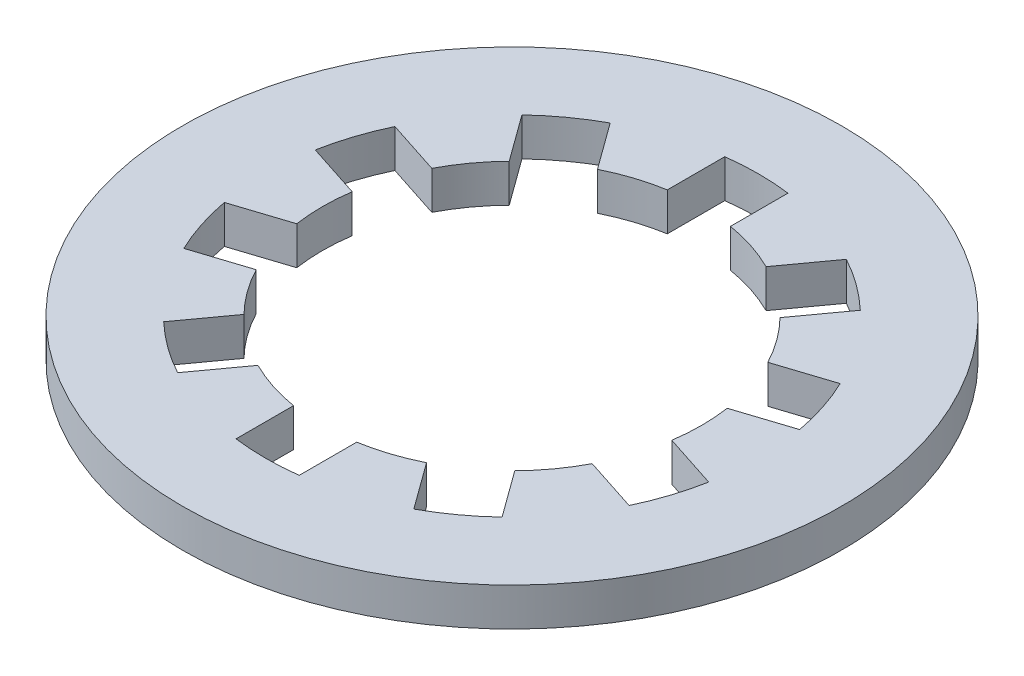
from build123d import *

# Parameters (mm, degrees)
SKETCH1_R          = 8.7884
SKETCH1_R_2        = 5.0546
EXTRUDE1_DEPTH     = 1.016
CUT_EXTRUDE1_DEPTH = 13.470132522
CIRPATTERN1_COUNT  = 10


with BuildPart() as part:
    # Sketch1 → Extrude1 (new body)
    with BuildSketch(Plane(origin=(0, 0, 0), x_dir=(1, 0, 0), z_dir=(0, 1, 0))):
        Circle(SKETCH1_R)
        Circle(SKETCH1_R_2, mode=Mode.SUBTRACT)
    extrude(amount=EXTRUDE1_DEPTH)

    # Sketch2 → Cut-Extrude1 (cut, through all)
    with BuildSketch(Plane(origin=(0, 1.016, 0), x_dir=(-1, 0, 0), z_dir=(0, 1, 0))):
        with BuildLine():
            Line((-0.842433333, 6.516754118), (-0.842433333, 4.983902812))
            ThreePointArc((-0.842433333, 4.983902812), (0, 5.0546), (0.842433333, 4.983902812))
            Line((0.842433333, 4.983902812), (0.842433333, 6.516754118))
            ThreePointArc((0.842433333, 6.516754118), (0, 6.57098), (-0.842433333, 6.516754118))
        make_face()
    cut_extrude1 = extrude(amount=-CUT_EXTRUDE1_DEPTH, mode=Mode.SUBTRACT)

    # CirPattern1: Cut-Extrude1 ×10 about axis
    cirpattern1_axis = Axis((0, 8.202925151, 0), (0, -1, 0))
    for i in range(1, CIRPATTERN1_COUNT):
        add(cut_extrude1.rotate(cirpattern1_axis, i * 360 / CIRPATTERN1_COUNT), mode=Mode.SUBTRACT)


solid = part.part
